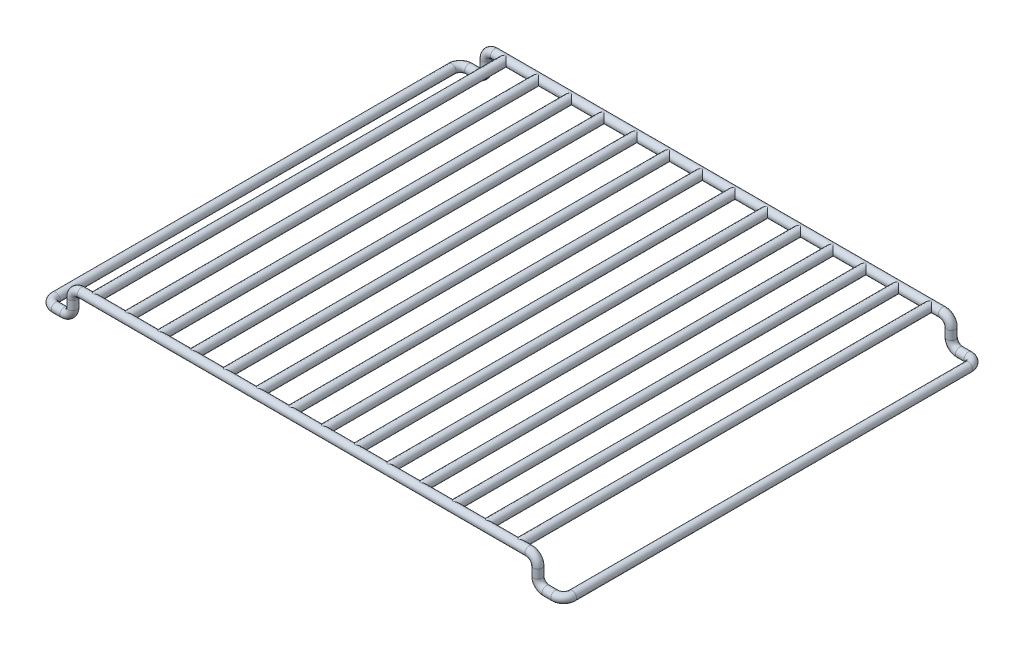
from build123d import *

# Parameters (mm, degrees)
SWEEP1_PROFILE_R                     = 2.5
BOSS_EXTRUDE1_REACH                  = 198.389
BOSS_EXTRUDE1_END_RADIUS             = 2.5
SKETCH14_R                           = 2.5
BOSS_EXTRUDE1_DIRECTION_2_REACH      = 198.389
BOSS_EXTRUDE1_DIRECTION_2_END_RADIUS = 2.5


with BuildPart() as part:
    # Sweep1: sweep along a curve in space
    with BuildLine() as sweep1_path:
        Line((0, 0, 120), (130, 0, 120))
        ThreePointArc((130, 0, 120), (133.535533906, -1.464466094, 120), (135, -5, 120))
        Line((135, -5, 120), (135, -10, 120))
        ThreePointArc((135, -10, 120), (136.464466094, -13.535533906, 120), (140, -15, 120))
        Line((140, -15, 120), (145, -15, 120))
        ThreePointArc((145, -15, 120), (148.535533906, -15, 118.535533906), (150, -15, 115))
        Line((150, -15, 115), (150, -15, -115))
        ThreePointArc((150, -15, -115), (148.535533906, -15, -118.535533906), (145, -15, -120))
        Line((145, -15, -120), (140, -15, -120))
        ThreePointArc((140, -15, -120), (136.464466094, -13.535533906, -120), (135, -10, -120))
        Line((135, -10, -120), (135, -5, -120))
        ThreePointArc((135, -5, -120), (133.535533906, -1.464466094, -120), (130, 0, -120))
        Line((130, 0, -120), (0, 0, -120))
    # Sweep1 profile (on start of the path) → Sweep1 (sweep)
    with BuildSketch(Plane(origin=(0, 0, 120), x_dir=(0, 0, 1), z_dir=(1, 0, 0))):
        Circle(SWEEP1_PROFILE_R)
    sweep(path=sweep1_path.line)

    # Boss-Extrude1: up to this cylinder (the profile starts outside it)
    boss_extrude1_end = Plane(origin=(66.5, 0, 120), z_dir=(1, 0, 0)) * Cylinder(BOSS_EXTRUDE1_END_RADIUS, 516.778, mode=Mode.PRIVATE)
    # Sketch14 → Boss-Extrude1 (add, up to the surface)
    with BuildSketch(Plane.XY, mode=Mode.PRIVATE) as boss_extrude1_sk1:
        with Locations(Location((9.5, 0, 0), (0, 0, 270))):
            Circle(SKETCH14_R)
    boss_extrude1_tool1 = extrude(boss_extrude1_sk1.sketch, amount=BOSS_EXTRUDE1_REACH, mode=Mode.PRIVATE) - boss_extrude1_end
    add(boss_extrude1_tool1.solids().sort_by_distance((9.5, 0, 0))[0])
    # Sketch14 → Boss-Extrude1 (add, up to the surface)
    with BuildSketch(Plane.XY, mode=Mode.PRIVATE) as boss_extrude1_sk2:
        with Locations(Location((28.5, 0, 0), (0, 0, 270))):
            Circle(SKETCH14_R)
    boss_extrude1_tool2 = extrude(boss_extrude1_sk2.sketch, amount=BOSS_EXTRUDE1_REACH, mode=Mode.PRIVATE) - boss_extrude1_end
    add(boss_extrude1_tool2.solids().sort_by_distance((28.5, 0, 0))[0])
    # Sketch14 → Boss-Extrude1 (add, up to the surface)
    with BuildSketch(Plane.XY, mode=Mode.PRIVATE) as boss_extrude1_sk3:
        with Locations(Location((47.5, 0, 0), (0, 0, 270))):
            Circle(SKETCH14_R)
    boss_extrude1_tool3 = extrude(boss_extrude1_sk3.sketch, amount=BOSS_EXTRUDE1_REACH, mode=Mode.PRIVATE) - boss_extrude1_end
    add(boss_extrude1_tool3.solids().sort_by_distance((47.5, 0, 0))[0])
    # Sketch14 → Boss-Extrude1 (add, up to the surface)
    with BuildSketch(Plane.XY, mode=Mode.PRIVATE) as boss_extrude1_sk4:
        with Locations(Location((66.5, 0, 0), (0, 0, 270))):
            Circle(SKETCH14_R)
    boss_extrude1_tool4 = extrude(boss_extrude1_sk4.sketch, amount=BOSS_EXTRUDE1_REACH, mode=Mode.PRIVATE) - boss_extrude1_end
    add(boss_extrude1_tool4.solids().sort_by_distance((66.5, 0, 0))[0])
    # Sketch14 → Boss-Extrude1 (add, up to the surface)
    with BuildSketch(Plane.XY, mode=Mode.PRIVATE) as boss_extrude1_sk5:
        with Locations(Location((85.5, 0, 0), (0, 0, 270))):
            Circle(SKETCH14_R)
    boss_extrude1_tool5 = extrude(boss_extrude1_sk5.sketch, amount=BOSS_EXTRUDE1_REACH, mode=Mode.PRIVATE) - boss_extrude1_end
    add(boss_extrude1_tool5.solids().sort_by_distance((85.5, 0, 0))[0])
    # Sketch14 → Boss-Extrude1 (add, up to the surface)
    with BuildSketch(Plane.XY, mode=Mode.PRIVATE) as boss_extrude1_sk6:
        with Locations(Location((104.5, 0, 0), (0, 0, 270))):
            Circle(SKETCH14_R)
    boss_extrude1_tool6 = extrude(boss_extrude1_sk6.sketch, amount=BOSS_EXTRUDE1_REACH, mode=Mode.PRIVATE) - boss_extrude1_end
    add(boss_extrude1_tool6.solids().sort_by_distance((104.5, 0, 0))[0])
    # Sketch14 → Boss-Extrude1 (add, up to the surface)
    with BuildSketch(Plane.XY, mode=Mode.PRIVATE) as boss_extrude1_sk7:
        with Locations(Location((123.5, 0, 0), (0, 0, 270))):
            Circle(SKETCH14_R)
    boss_extrude1_tool7 = extrude(boss_extrude1_sk7.sketch, amount=BOSS_EXTRUDE1_REACH, mode=Mode.PRIVATE) - boss_extrude1_end
    add(boss_extrude1_tool7.solids().sort_by_distance((123.5, 0, 0))[0])

    # Boss-Extrude1 direction 2: up to this cylinder (the profile starts outside it)
    boss_extrude1_direction_2_end = Plane(origin=(66.5, 0, -120), z_dir=(-1, 0, 0)) * Cylinder(BOSS_EXTRUDE1_DIRECTION_2_END_RADIUS, 516.778, mode=Mode.PRIVATE)
    # Sketch14 → Boss-Extrude1 direction 2 (add, up to the surface)
    with BuildSketch(Plane.XY, mode=Mode.PRIVATE) as boss_extrude1_direction_2_sk1:
        with Locations(Location((9.5, 0, 0), (0, 0, 270))):
            Circle(SKETCH14_R)
    boss_extrude1_direction_2_tool1 = extrude(boss_extrude1_direction_2_sk1.sketch, amount=-BOSS_EXTRUDE1_DIRECTION_2_REACH, mode=Mode.PRIVATE) - boss_extrude1_direction_2_end
    add(boss_extrude1_direction_2_tool1.solids().sort_by_distance((9.5, 0, 0))[0])
    # Sketch14 → Boss-Extrude1 direction 2 (add, up to the surface)
    with BuildSketch(Plane.XY, mode=Mode.PRIVATE) as boss_extrude1_direction_2_sk2:
        with Locations(Location((28.5, 0, 0), (0, 0, 270))):
            Circle(SKETCH14_R)
    boss_extrude1_direction_2_tool2 = extrude(boss_extrude1_direction_2_sk2.sketch, amount=-BOSS_EXTRUDE1_DIRECTION_2_REACH, mode=Mode.PRIVATE) - boss_extrude1_direction_2_end
    add(boss_extrude1_direction_2_tool2.solids().sort_by_distance((28.5, 0, 0))[0])
    # Sketch14 → Boss-Extrude1 direction 2 (add, up to the surface)
    with BuildSketch(Plane.XY, mode=Mode.PRIVATE) as boss_extrude1_direction_2_sk3:
        with Locations(Location((47.5, 0, 0), (0, 0, 270))):
            Circle(SKETCH14_R)
    boss_extrude1_direction_2_tool3 = extrude(boss_extrude1_direction_2_sk3.sketch, amount=-BOSS_EXTRUDE1_DIRECTION_2_REACH, mode=Mode.PRIVATE) - boss_extrude1_direction_2_end
    add(boss_extrude1_direction_2_tool3.solids().sort_by_distance((47.5, 0, 0))[0])
    # Sketch14 → Boss-Extrude1 direction 2 (add, up to the surface)
    with BuildSketch(Plane.XY, mode=Mode.PRIVATE) as boss_extrude1_direction_2_sk4:
        with Locations(Location((66.5, 0, 0), (0, 0, 270))):
            Circle(SKETCH14_R)
    boss_extrude1_direction_2_tool4 = extrude(boss_extrude1_direction_2_sk4.sketch, amount=-BOSS_EXTRUDE1_DIRECTION_2_REACH, mode=Mode.PRIVATE) - boss_extrude1_direction_2_end
    add(boss_extrude1_direction_2_tool4.solids().sort_by_distance((66.5, 0, 0))[0])
    # Sketch14 → Boss-Extrude1 direction 2 (add, up to the surface)
    with BuildSketch(Plane.XY, mode=Mode.PRIVATE) as boss_extrude1_direction_2_sk5:
        with Locations(Location((85.5, 0, 0), (0, 0, 270))):
            Circle(SKETCH14_R)
    boss_extrude1_direction_2_tool5 = extrude(boss_extrude1_direction_2_sk5.sketch, amount=-BOSS_EXTRUDE1_DIRECTION_2_REACH, mode=Mode.PRIVATE) - boss_extrude1_direction_2_end
    add(boss_extrude1_direction_2_tool5.solids().sort_by_distance((85.5, 0, 0))[0])
    # Sketch14 → Boss-Extrude1 direction 2 (add, up to the surface)
    with BuildSketch(Plane.XY, mode=Mode.PRIVATE) as boss_extrude1_direction_2_sk6:
        with Locations(Location((104.5, 0, 0), (0, 0, 270))):
            Circle(SKETCH14_R)
    boss_extrude1_direction_2_tool6 = extrude(boss_extrude1_direction_2_sk6.sketch, amount=-BOSS_EXTRUDE1_DIRECTION_2_REACH, mode=Mode.PRIVATE) - boss_extrude1_direction_2_end
    add(boss_extrude1_direction_2_tool6.solids().sort_by_distance((104.5, 0, 0))[0])
    # Sketch14 → Boss-Extrude1 direction 2 (add, up to the surface)
    with BuildSketch(Plane.XY, mode=Mode.PRIVATE) as boss_extrude1_direction_2_sk7:
        with Locations(Location((123.5, 0, 0), (0, 0, 270))):
            Circle(SKETCH14_R)
    boss_extrude1_direction_2_tool7 = extrude(boss_extrude1_direction_2_sk7.sketch, amount=-BOSS_EXTRUDE1_DIRECTION_2_REACH, mode=Mode.PRIVATE) - boss_extrude1_direction_2_end
    add(boss_extrude1_direction_2_tool7.solids().sort_by_distance((123.5, 0, 0))[0])

    # Mirror1: part across plane


with BuildPart() as part_1:
    add(part.part)
    add(part.part.mirror(Plane(origin=(0, 0, 0), x_dir=(0, 0, 1), z_dir=(1, 0, 0))))


solid = part_1.part
